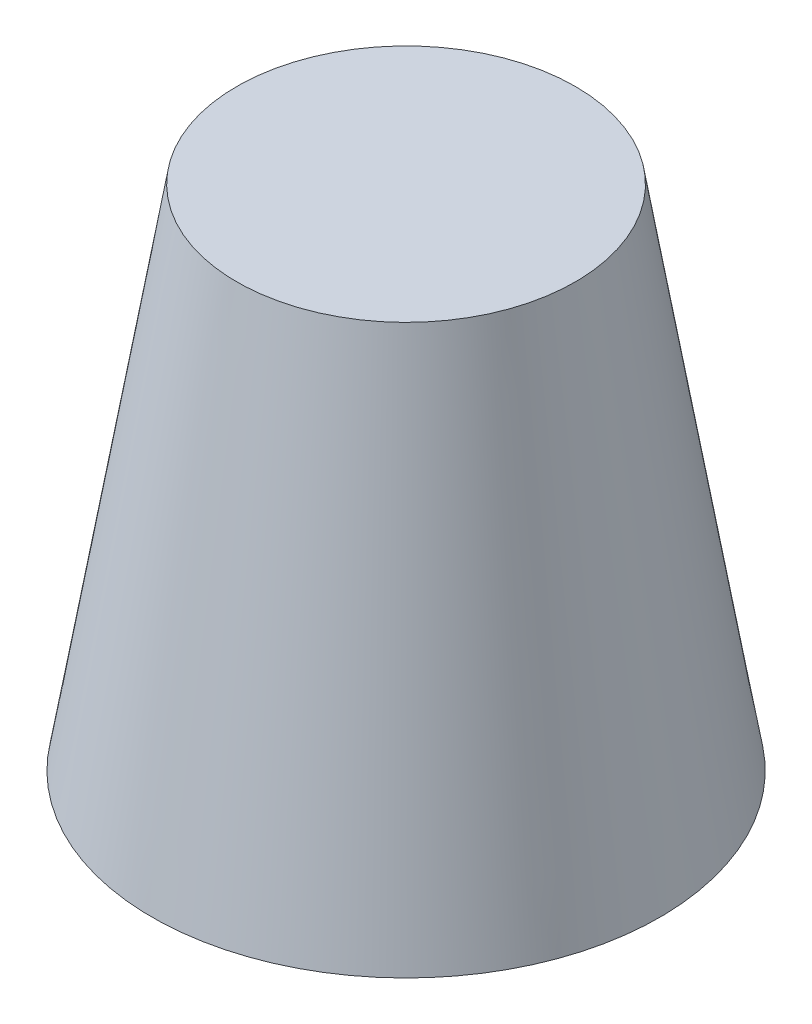
from build123d import *


with BuildPart() as part:
    # 草图1 → 旋转1 (revolve)
    with BuildSketch(Plane.XY, mode=Mode.PRIVATE) as revolve_1_sk:
        Polygon((0, 60), (0, 57), (3, 57), (17.458618735, 57), (26.458618735, 3), (24.22, 3), (25, 0), (30, 0), (20, 60), align=None)
    revolve(revolve_1_sk.sketch.rotate(Axis((0, 0, 0), (0, 1, 0)), 90), axis=Axis((0, 0, 0), (0, 1, 0)))


solid = part.part
